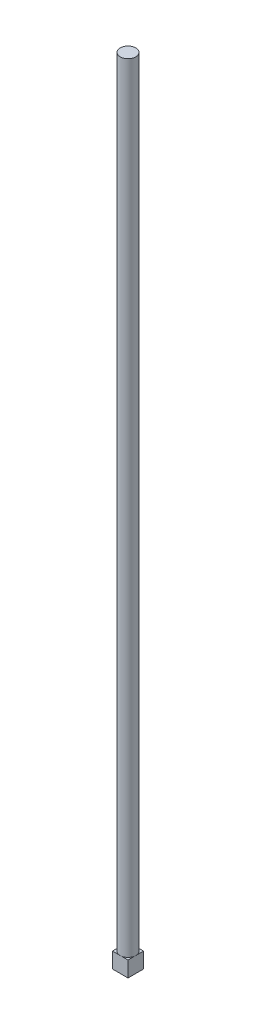
from build123d import *

# Parameters (mm, degrees)
SKETCH1_W           = 25.4
SKETCH1_H           = 25.4
BOSS_EXTRUDE1_DEPTH = 25.4
BOSS_EXTRUDE2_DEPTH = 1270


with BuildPart() as part:
    # Sketch1 → Boss-Extrude1 (new body)
    with BuildSketch(Plane(origin=(0, 0, 0), x_dir=(1, 0, 0), z_dir=(0, 1, 0))):
        Rectangle(SKETCH1_W, SKETCH1_H)
    extrude(amount=-BOSS_EXTRUDE1_DEPTH)

    # Sketch1<3> → Boss-Extrude2 (add)
    with BuildSketch(Plane(origin=(0, 0, 0), x_dir=(1, 0, 0), z_dir=(0, 1, 0))):
        with BuildLine():
            ThreePointArc((12.7, 0), (8.980256121, 8.980256121), (0, 12.7))
            ThreePointArc((0, 12.7), (-8.980256132, 8.98025611), (-12.7, -3e-08))
            ThreePointArc((-12.7, -3e-08), (-8.98025611, -8.980256132), (0, -12.7))
            ThreePointArc((0, -12.7), (8.980256121, -8.980256121), (12.7, 0))
        make_face()
    extrude(amount=BOSS_EXTRUDE2_DEPTH)


solid = part.part
